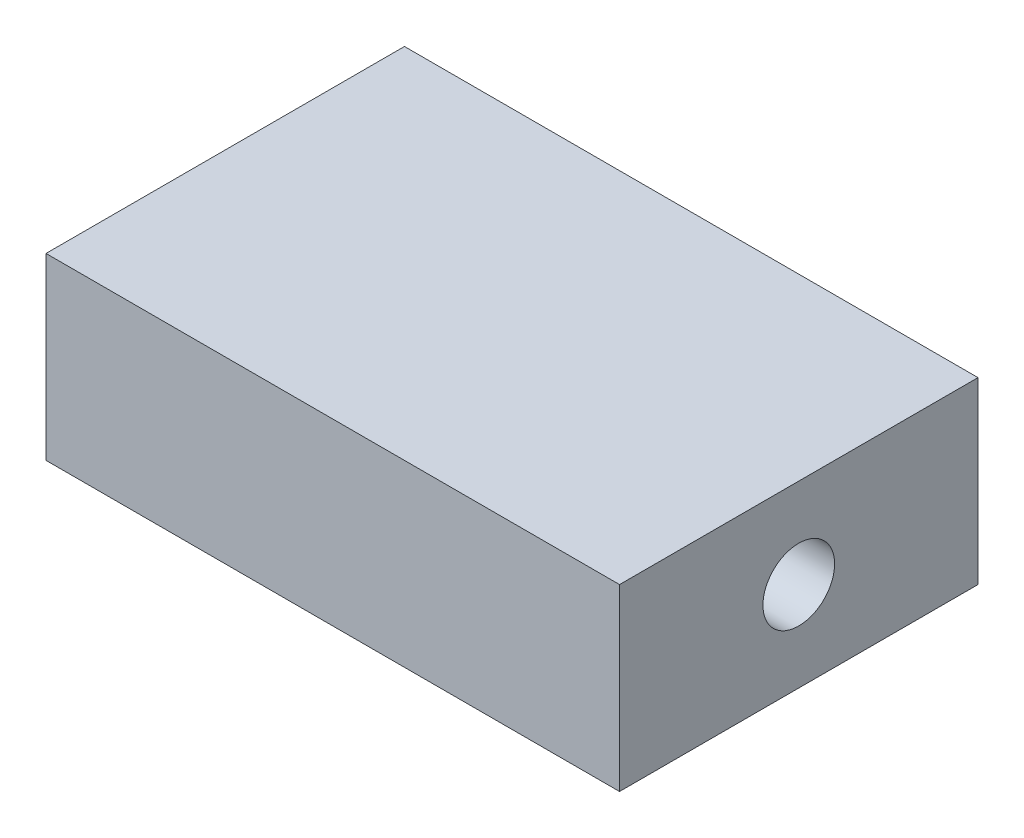
from build123d import *

# Parameters (mm, degrees)
SKETCH1_W               = 80
SKETCH1_H               = 50
BOSS_EXTRUDE1_DEPTH     = 25
CUT_EXTRUDE1_DEPTH      = 54.38539126
CUT_EXTRUDE1_DEPTH_BACK = 54.38539126
SKETCH2_R               = 5


with BuildPart() as part:
    # Sketch1 → Boss-Extrude1 (new body)
    with BuildSketch(Plane(origin=(0, 0, 0), x_dir=(1, 0, 0), z_dir=(0, 1, 0))):
        Rectangle(SKETCH1_W, SKETCH1_H)
    extrude(amount=BOSS_EXTRUDE1_DEPTH)

    # Sketch2 → Cut-Extrude1 (cut, two sides: drawn at the far end of the back side and taken through both)
    with BuildSketch(Plane(origin=(0, 0, 0), x_dir=(0, 0, -1), z_dir=(1, 0, 0)).offset(-CUT_EXTRUDE1_DEPTH_BACK)):
        with Locations((0, 12.5)):
            Circle(SKETCH2_R)
    extrude(amount=CUT_EXTRUDE1_DEPTH + CUT_EXTRUDE1_DEPTH_BACK, mode=Mode.SUBTRACT)


solid = part.part
